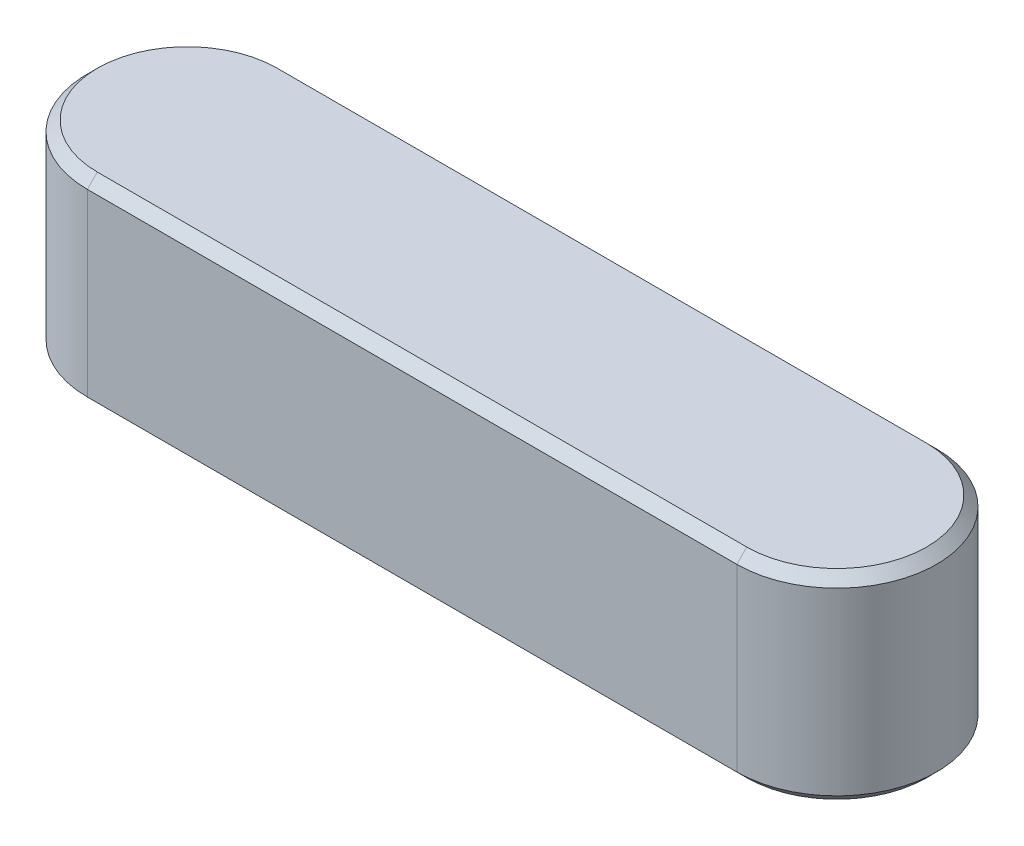
from build123d import *

# Parameters (mm, degrees)
BOSS_EXTRUDE2_DEPTH = 4
CHAMFER2_SIZE       = 0.2


with BuildPart() as part:
    # Sketch2 → Boss-Extrude2 (new body)
    with BuildSketch(Plane(origin=(0, 0, 0), x_dir=(1, 0, 0), z_dir=(0, 1, 0))):
        with BuildLine():
            Line((0, 2), (13, 2))
            ThreePointArc((13, 2), (15, 0), (13, -2))
            Line((13, -2), (0, -2))
            ThreePointArc((0, -2), (-2, 0), (0, 2))
        make_face()
    extrude(amount=BOSS_EXTRUDE2_DEPTH)

    # Chamfer2
    chamfer2_edges = [part.edges().sort_by_distance(p)[0] for p in [
        (15, 4, 0),
        (6.5, 4, -2),
        (-2, 4, 0),
        (6.5, 0, -2),
        (15, 0, 0),
        (6.5, 0, 2),
        (-2, 0, 0),
        (6.5, 4, 2),
    ]]
    chamfer(chamfer2_edges, length=CHAMFER2_SIZE)


solid = part.part
